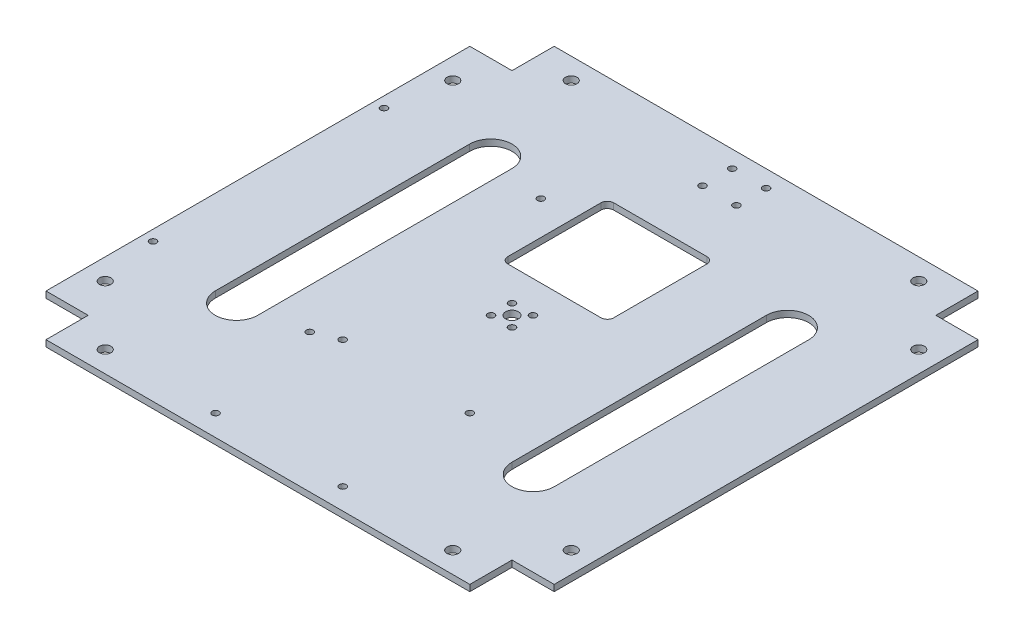
from build123d import *

# Parameters (mm, degrees)
SKETCH_1_W          = 239.8
SKETCH_1_H          = 239.8
SKETCH_1_R          = 3
SKETCH_1_R_2        = 1.6
EXTRUDE_1_DEPTH     = 3
SKETCH_2_R          = 1.6
SKETCH_2_W          = 19.9
SKETCH_2_H          = 19.9
CUT_EXTRUDE_2_DEPTH = 3
SKETCH_3_R          = 1.6
CUT_EXTRUDE_3_DEPTH = 3
SKETCH_4_W          = 50
SKETCH_4_H          = 50
CUT_EXTRUDE_4_DEPTH = 3
FILLET_1_R          = 3
SKETCH_5_R          = 2.7
CUT_EXTRUDE_5_DEPTH = 3
SKETCH_6_R          = 1.6
CUT_EXTRUDE_7_DEPTH = 3


with BuildPart() as part:
    # 草图1 → 凸台-拉伸1 (new body)
    with BuildSketch(Plane(origin=(0, 0, 0), x_dir=(1, 0, 0), z_dir=(0, 1, 0))):
        Rectangle(SKETCH_1_W, SKETCH_1_H)
        with Locations(Location((0, 0, 0), (0, 0, 270))):
            Circle(SKETCH_1_R, mode=Mode.SUBTRACT)
        with Locations(Location((4.949747468, 4.949747468, 0), (0, 0, 270))):
            Circle(SKETCH_1_R_2, mode=Mode.SUBTRACT)
        with Locations(Location((4.949747468, -4.949747468, 0), (0, 0, 270))):
            Circle(SKETCH_1_R_2, mode=Mode.SUBTRACT)
        with Locations(Location((-4.949747468, -4.949747468, 0), (0, 0, 270))):
            Circle(SKETCH_1_R_2, mode=Mode.SUBTRACT)
        with Locations(Location((-4.949747468, 4.949747468, 0), (0, 0, 270))):
            Circle(SKETCH_1_R_2, mode=Mode.SUBTRACT)
    extrude(amount=EXTRUDE_1_DEPTH)

    # 草图2 → 切除-拉伸2 (cut)
    with BuildSketch(Plane(origin=(0, 3, 0), x_dir=(1, 0, 0), z_dir=(0, 1, 0))):
        with Locations(Location((-8, 111.9, 0), (0, 0, 270))):
            Circle(SKETCH_2_R)
        with Locations(Location((8, 111.9, 0), (0, 0, 90))):
            Circle(SKETCH_2_R)
        with Locations(Location((8, 97.9, 0), (0, 0, 270))):
            Circle(SKETCH_2_R)
        with Locations(Location((-8, 97.9, 0), (0, 0, 90))):
            Circle(SKETCH_2_R)
        with Locations((109.95, 109.95)):
            Rectangle(SKETCH_2_W, SKETCH_2_H)
        with Locations((-109.95, 109.95)):
            Rectangle(SKETCH_2_W, SKETCH_2_H)
        with Locations((109.95, -109.95)):
            Rectangle(SKETCH_2_W, SKETCH_2_H)
        with Locations((-109.95, -109.95)):
            Rectangle(SKETCH_2_W, SKETCH_2_H)
    extrude(amount=-CUT_EXTRUDE_2_DEPTH, mode=Mode.SUBTRACT)

    # 草图3 → 切除-拉伸3 (cut)
    with BuildSketch(Plane(origin=(0, 3, 0), x_dir=(1, 0, 0), z_dir=(0, 1, 0))):
        with Locations(Location((-30, -49.9, 0), (0, 0, 270))):
            Circle(SKETCH_3_R)
        with Locations(Location((30, -49.9, 0), (0, 0, 90))):
            Circle(SKETCH_3_R)
        with Locations(Location((-30, -109.9, 0), (0, 0, 90))):
            Circle(SKETCH_3_R)
        with Locations(Location((30, -109.9, 0), (0, 0, 270))):
            Circle(SKETCH_3_R)
    extrude(amount=-CUT_EXTRUDE_3_DEPTH, mode=Mode.SUBTRACT)

    # 草图4 → 切除-拉伸4 (cut)
    with BuildSketch(Plane(origin=(0, 3, 0), x_dir=(1, 0, 0), z_dir=(0, 1, 0))):
        with BuildLine():
            Line((-60, 60), (-60, -60))
            ThreePointArc((-60, -60), (-70, -70), (-80, -60))
            Line((-80, -60), (-80, 60))
            ThreePointArc((-80, 60), (-70, 70), (-60, 60))
        make_face()
        with BuildLine():
            Line((80, 60), (80, -60))
            ThreePointArc((80, -60), (70, -70), (60, -60))
            Line((60, -60), (60, 60))
            ThreePointArc((60, 60), (70, 70), (80, 60))
        make_face()
        with Locations((0, 45)):
            Rectangle(SKETCH_4_W, SKETCH_4_H)
    extrude(amount=-CUT_EXTRUDE_4_DEPTH, mode=Mode.SUBTRACT)

    # 圆角1
    fillet_1_edges = [part.edges().sort_by_distance(p)[0] for p in [
        (25, 1.5, -70),
        (25, 1.5, -20),
        (-25, 1.5, -20),
        (-25, 1.5, -70),
    ]]
    fillet(fillet_1_edges, radius=FILLET_1_R)

    # 草图5 → 切除-拉伸5 (cut)
    with BuildSketch(Plane(origin=(0, 3, 0), x_dir=(1, 0, 0), z_dir=(0, 1, 0))):
        with Locations(Location((-109.95, 82, 0), (0, 0, 270))):
            Circle(SKETCH_5_R)
        with Locations(Location((-82, 109.95, 0), (0, 0, 90))):
            Circle(SKETCH_5_R)
        with Locations(Location((-109.95, -82, 0), (0, 0, 90))):
            Circle(SKETCH_5_R)
        with Locations(Location((-82, -109.95, 0), (0, 0, 270))):
            Circle(SKETCH_5_R)
        with Locations(Location((109.95, 82, 0), (0, 0, 90))):
            Circle(SKETCH_5_R)
        with Locations(Location((82, 109.95, 0), (0, 0, 270))):
            Circle(SKETCH_5_R)
        with Locations(Location((109.95, -82, 0), (0, 0, 270))):
            Circle(SKETCH_5_R)
        with Locations(Location((82, -109.95, 0), (0, 0, 90))):
            Circle(SKETCH_5_R)
    extrude(amount=-CUT_EXTRUDE_5_DEPTH, mode=Mode.SUBTRACT)

    # 草图6 → 切除-拉伸7 (cut)
    with BuildSketch(Plane(origin=(0, 3, 0), x_dir=(1, 0, 0), z_dir=(0, 1, 0))):
        with Locations(Location((-114.9, 54.5, 0), (0, 0, 270))):
            Circle(SKETCH_6_R)
        with Locations(Location((-40.9, 54.5, 0), (0, 0, 270))):
            Circle(SKETCH_6_R)
        with Locations(Location((-114.9, -54.5, 0), (0, 0, 90))):
            Circle(SKETCH_6_R)
        with Locations(Location((-40.9, -54.5, 0), (0, 0, 270))):
            Circle(SKETCH_6_R)
    extrude(amount=-CUT_EXTRUDE_7_DEPTH, mode=Mode.SUBTRACT)


solid = part.part
